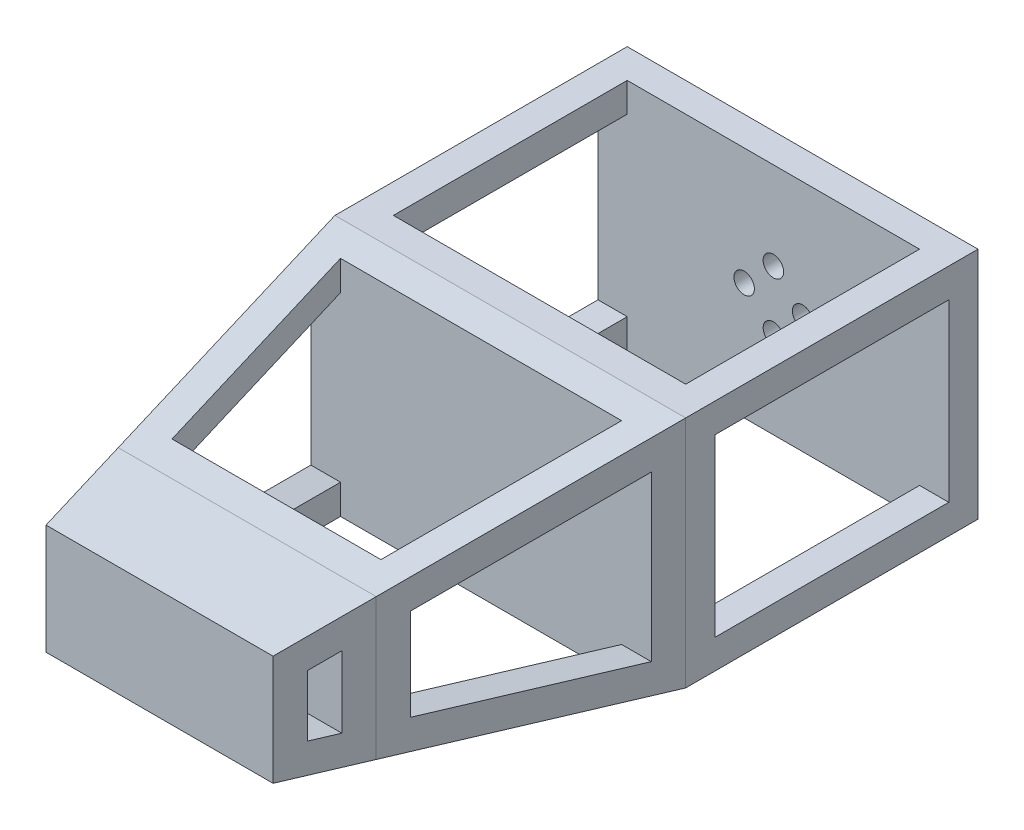
from build123d import *

# Parameters (mm, degrees)
SKETCH1_W           = 60
SKETCH1_H           = 40
BOSS_EXTRUDE1_DEPTH = 50
SKETCH2_W           = 50
SKETCH2_H           = 30
CUT_EXTRUDE1_DEPTH  = 45
SKETCH3_W           = 50
SKETCH3_H           = 40
CUT_EXTRUDE2_DEPTH  = 45
SKETCH4_W           = 40
SKETCH4_H           = 30
CUT_EXTRUDE3_DEPTH  = 81.622577483
SKETCH5_W           = 60
SKETCH5_H           = 40
BOSS_EXTRUDE2_DEPTH = 45
BOSS_EXTRUDE2_TAPER = 10
CUT_EXTRUDE6_DEPTH  = 109.034251597
CUT_EXTRUDE7_DEPTH  = 114.321745988
SKETCH10_W          = 44.130571736
SKETCH10_H          = 24.130571736
BOSS_EXTRUDE3_DEPTH = 15
BOSS_EXTRUDE3_TAPER = 9.999999999
CUT_EXTRUDE8_DEPTH  = 114.321745988
SKETCH17_R          = 1.75
CUT_EXTRUDE10_DEPTH = 10


with BuildPart() as part:
    # Sketch1 → Boss-Extrude1 (new body)
    with BuildSketch(Plane.XY):
        Rectangle(SKETCH1_W, SKETCH1_H)
    extrude(amount=BOSS_EXTRUDE1_DEPTH)

    # Sketch2 → Cut-Extrude1 (cut)
    with BuildSketch(Plane.XY.offset(50)):
        Rectangle(SKETCH2_W, SKETCH2_H)
    extrude(amount=-CUT_EXTRUDE1_DEPTH, mode=Mode.SUBTRACT)

    # Sketch3 → Cut-Extrude2 (cut)
    with BuildSketch(Plane(origin=(0, 20, 0), x_dir=(1, 0, 0), z_dir=(0, 1, 0))):
        with Locations((0, -25)):
            Rectangle(SKETCH3_W, SKETCH3_H)
    extrude(amount=-CUT_EXTRUDE2_DEPTH, mode=Mode.SUBTRACT)

    # Sketch4 → Cut-Extrude3 (cut, through all)
    with BuildSketch(Plane(origin=(30, 0, 0), x_dir=(0, 0, -1), z_dir=(1, 0, 0))):
        with Locations((-25, 0)):
            Rectangle(SKETCH4_W, SKETCH4_H)
    extrude(amount=-CUT_EXTRUDE3_DEPTH, mode=Mode.SUBTRACT)

    # Sketch5 → Boss-Extrude2 (add)
    with BuildSketch(Plane.XY.offset(50)):
        Rectangle(SKETCH5_W, SKETCH5_H)
    extrude(amount=BOSS_EXTRUDE2_DEPTH, taper=BOSS_EXTRUDE2_TAPER)

    # Sketch6 → Cut-Extrude6 (cut, through all)
    with BuildSketch(Plane(origin=(0, 20, 95.767424097), x_dir=(1, 0, 0), z_dir=(0, -1, 0))):
        Polygon((-24.041232037, -40.767424097), (24.041232037, -40.767424097), (17.869787712, -5.767424097), (-17.869787712, -5.767424097), align=None)
    extrude(amount=CUT_EXTRUDE6_DEPTH, mode=Mode.SUBTRACT)

    # Sketch9 → Cut-Extrude7 (cut, through all)
    with BuildSketch(Plane(origin=(30, 0, 94.030942321), x_dir=(0, 0, 1), z_dir=(-1, 0, 0))):
        Polygon((-39.030942321, 14.041232037), (-39.030942321, -14.041232037), (-4.030942321, -7.869787712), (-4.030942321, 7.869787712), align=None)
    extrude(amount=CUT_EXTRUDE7_DEPTH, mode=Mode.SUBTRACT)

    # Sketch17 → Cut-Extrude10 (cut)
    with BuildSketch(Plane(origin=(0, 0, 0), x_dir=(-1, 0, 0), z_dir=(0, 0, -1))):
        with Locations((-5, 0)):
            Circle(SKETCH17_R)
        with Locations((0, 5)):
            Circle(SKETCH17_R)
        with Locations(Location((5, 0, 0), (0, 0, 180))):
            Circle(SKETCH17_R)
        with Locations(Location((0, -5, 0), (0, 0, 180))):
            Circle(SKETCH17_R)
    extrude(amount=-CUT_EXTRUDE10_DEPTH, mode=Mode.SUBTRACT)


with BuildPart() as body_2:
    # Sketch10 → Boss-Extrude3 (new body)
    with BuildSketch(Plane.XY.offset(95)):
        Rectangle(SKETCH10_W, SKETCH10_H)
    extrude(amount=BOSS_EXTRUDE3_DEPTH, taper=BOSS_EXTRUDE3_TAPER)

    # Sketch15 → Cut-Extrude8 (cut, through all)
    with BuildSketch(Plane(origin=(30, 0, 94.030942321), x_dir=(0, 0, 1), z_dir=(-1, 0, 0))):
        Polygon((5.969057679, 6.106517905), (5.969057679, -6.106517905), (10.969057679, -5.224883002), (10.969057679, 5.224883002), align=None)
    extrude(amount=CUT_EXTRUDE8_DEPTH, mode=Mode.SUBTRACT)


solid = Compound([part.part, body_2.part])
